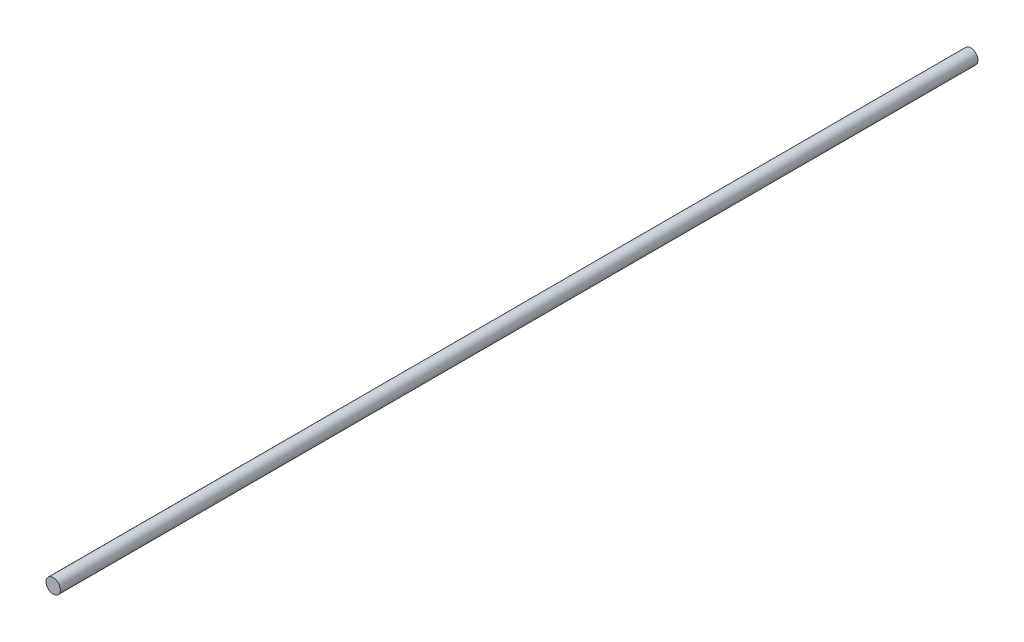
from build123d import *

# Parameters (mm, degrees)
SKETCH_1_R      = 4
EXTRUDE_1_DEPTH = 511.42


with BuildPart() as part:
    # 草图1 → 凸台-拉伸1 (new body)
    with BuildSketch(Plane.XY):
        with Locations((-14.814285714, 7.892857143)):
            Circle(SKETCH_1_R)
    extrude(amount=EXTRUDE_1_DEPTH)


solid = part.part
